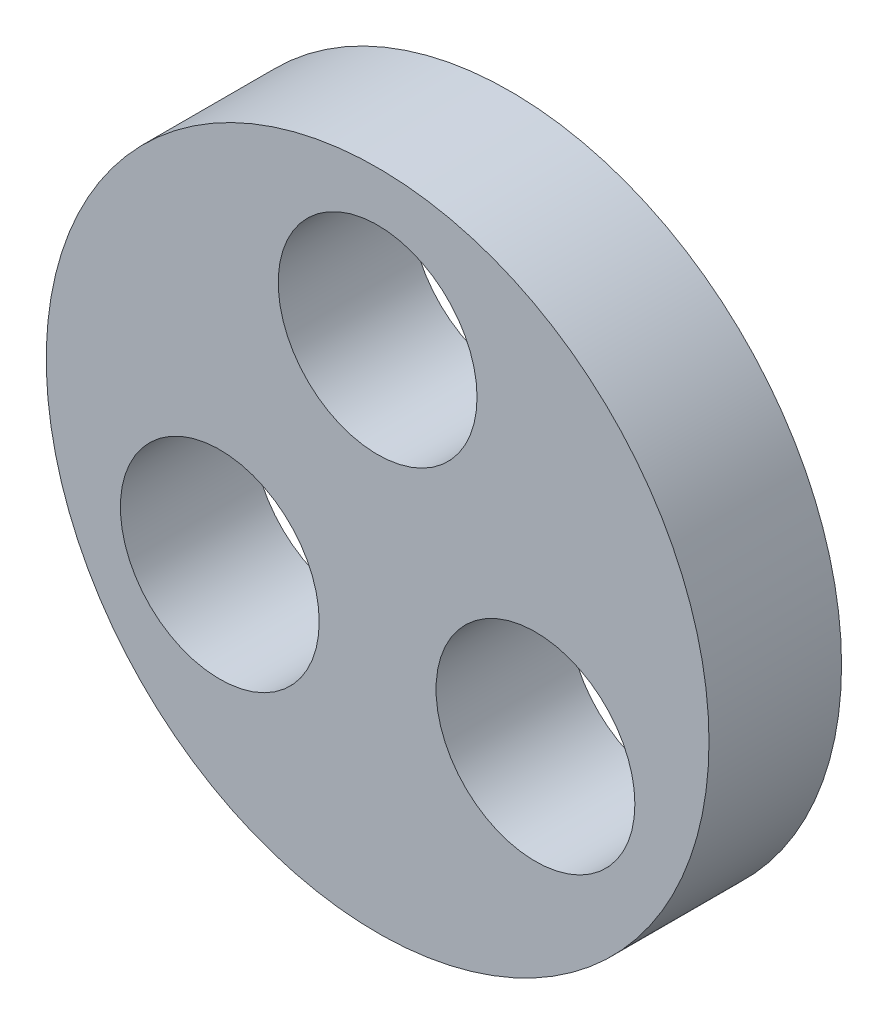
from build123d import *

# Parameters (mm, degrees)
SKETCH1_R           = 7.9375
SKETCH1_R_2         = 2.38125
BOSS_EXTRUDE1_DEPTH = 3.175


with BuildPart() as part:
    # Sketch1 → Boss-Extrude1 (new body)
    with BuildSketch(Plane.XY):
        Circle(SKETCH1_R)
        with Locations((0, 4.365625)):
            Circle(SKETCH1_R_2, mode=Mode.SUBTRACT)
        with Locations((3.780742153, -2.1828125)):
            Circle(SKETCH1_R_2, mode=Mode.SUBTRACT)
        with Locations((-3.780742153, -2.1828125)):
            Circle(SKETCH1_R_2, mode=Mode.SUBTRACT)
    extrude(amount=BOSS_EXTRUDE1_DEPTH)


solid = part.part
